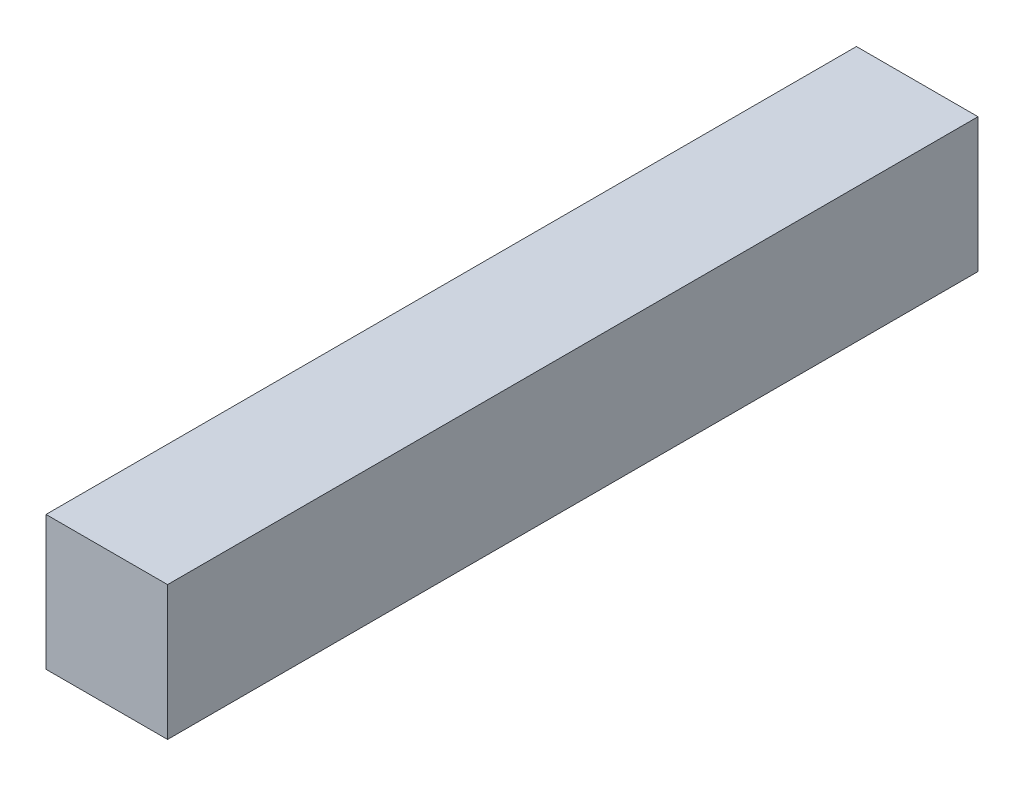
from build123d import *

# Parameters (mm, degrees)
SKETCH1_W           = 6
SKETCH1_H           = 6.62
BOSS_EXTRUDE1_DEPTH = 40


with BuildPart() as part:
    # Sketch1 → Boss-Extrude1 (new body)
    with BuildSketch(Plane.XY):
        with Locations((3, 3.31)):
            Rectangle(SKETCH1_W, SKETCH1_H)
    extrude(amount=BOSS_EXTRUDE1_DEPTH)


solid = part.part
